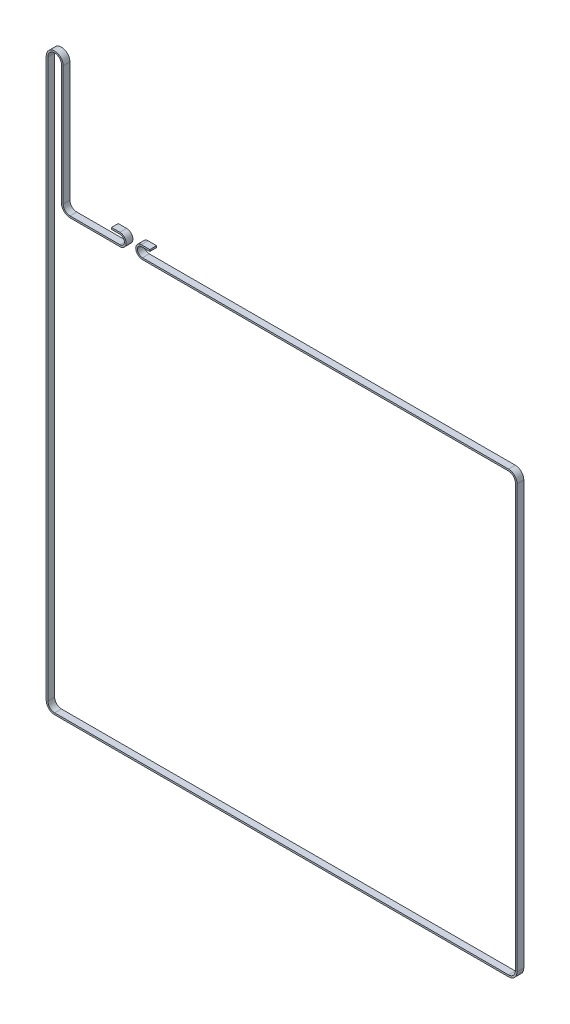
from build123d import *

# Parameters (mm, degrees)
BOSS_EXTRUDE1_DEPTH = 6


with BuildPart() as part:
    # Sketch1 → Boss-Extrude1 (new body)
    with BuildSketch(Plane.XY):
        with BuildLine():
            Line((-6, 0), (-6, -494.15))
            ThreePointArc((-6, -494.15), (-4.242640687, -498.392640687), (0, -500.15))
            Line((0, -500.15), (402, -500.15))
            ThreePointArc((402, -500.15), (406.242640687, -498.392640687), (408, -494.15))
            Line((408, -494.15), (408, -119.649819196))
            ThreePointArc((408, -119.649819196), (406.242640687, -115.407178509), (402, -113.649819196))
            Line((402, -113.649819196), (77.763956729, -113.649819196))
            ThreePointArc((77.763956729, -113.649819196), (73.509598553, -111.877262252), (71.772388716, -107.60834862))
            ThreePointArc((71.772388716, -107.60834862), (73.251375418, -104.099653504), (76.772216732, -102.649819196))
            Line((76.772216732, -102.649819196), (84.272216732, -102.649819196))
            Line((84.272216732, -102.649819196), (84.272216732, -104.149819196))
            Line((84.272216732, -104.149819196), (76.772216732, -104.149819196))
            ThreePointArc((76.772216732, -104.149819196), (74.343547137, -105.129588254), (73.274612012, -107.520354054))
            ThreePointArc((73.274612012, -107.520354054), (74.521274443, -110.783312955), (77.735886194, -112.149819196))
            Line((77.735886194, -112.149819196), (402, -112.149819196))
            ThreePointArc((402, -112.149819196), (407.303300859, -114.346518337), (409.5, -119.649819196))
            Line((409.5, -119.649819196), (409.5, -494.15))
            ThreePointArc((409.5, -494.15), (407.303300859, -499.453300859), (402, -501.65))
            Line((402, -501.65), (0, -501.65))
            ThreePointArc((0, -501.65), (-5.303300859, -499.453300859), (-7.5, -494.15))
            Line((-7.5, -494.15), (-7.5, 0))
            ThreePointArc((-7.5, 0), (0, 7.5), (7.5, 0))
            Line((7.5, 0), (7.5, -106.149819196))
            ThreePointArc((7.5, -106.149819196), (9.257359313, -110.392459883), (13.5, -112.149819196))
            Line((13.5, -112.149819196), (57.772216732, -112.149819196))
            ThreePointArc((57.772216732, -112.149819196), (61.772216732, -108.149819196), (57.772216732, -104.149819196))
            Line((57.772216732, -104.149819196), (50.272216732, -104.149819196))
            Line((50.272216732, -104.149819196), (50.272216732, -102.649819196))
            Line((50.272216732, -102.649819196), (57.772216732, -102.649819196))
            ThreePointArc((57.772216732, -102.649819196), (63.272216732, -108.149819196), (57.772216732, -113.649819196))
            Line((57.772216732, -113.649819196), (13.5, -113.649819196))
            ThreePointArc((13.5, -113.649819196), (8.196699141, -111.453120055), (6, -106.149819196))
            Line((6, -106.149819196), (6, 0))
            ThreePointArc((6, 0), (0, 6), (-6, 0))
        make_face()
    extrude(amount=BOSS_EXTRUDE1_DEPTH)


solid = part.part
